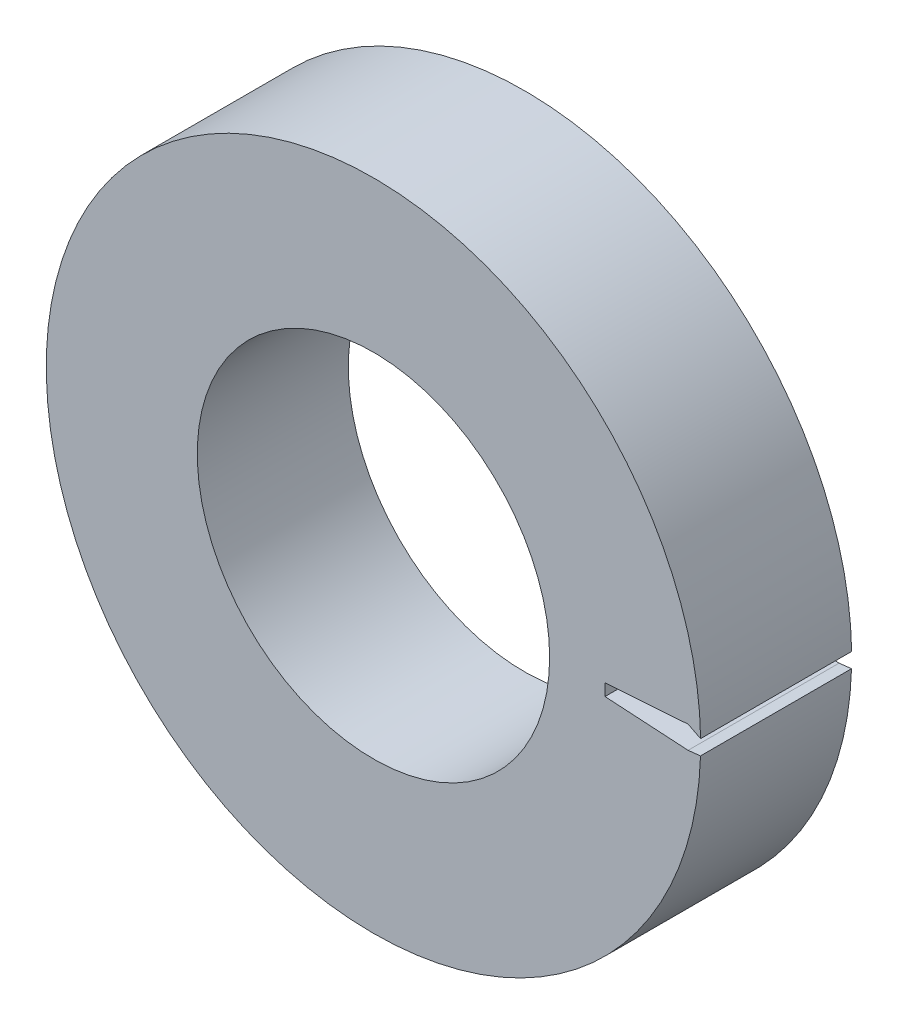
from build123d import *

# Parameters (mm, degrees)
SKETCH_1_R          = 65
SKETCH_1_R_2        = 35
STATOR_BLANK_DEPTH  = 15
SLOT_CUT_TEST_DEPTH = 20


with BuildPart() as part:
    # Эскиз1 → Stator_blank (new, symmetric)
    with BuildSketch(Plane.XY):
        Circle(SKETCH_1_R)
        Circle(SKETCH_1_R_2, mode=Mode.SUBTRACT)
    extrude(amount=STATOR_BLANK_DEPTH, both=True)

    # Эскиз2 → Slot_cut_test (cut, symmetric)
    with BuildSketch(Plane.XY):
        Polygon((46, -1.25), (62.5, -2.25), (67, -1.75), (67, 0), (62.5, 2.25), (46, 1.125), align=None)
    extrude(amount=SLOT_CUT_TEST_DEPTH, both=True, mode=Mode.SUBTRACT)


solid = part.part
